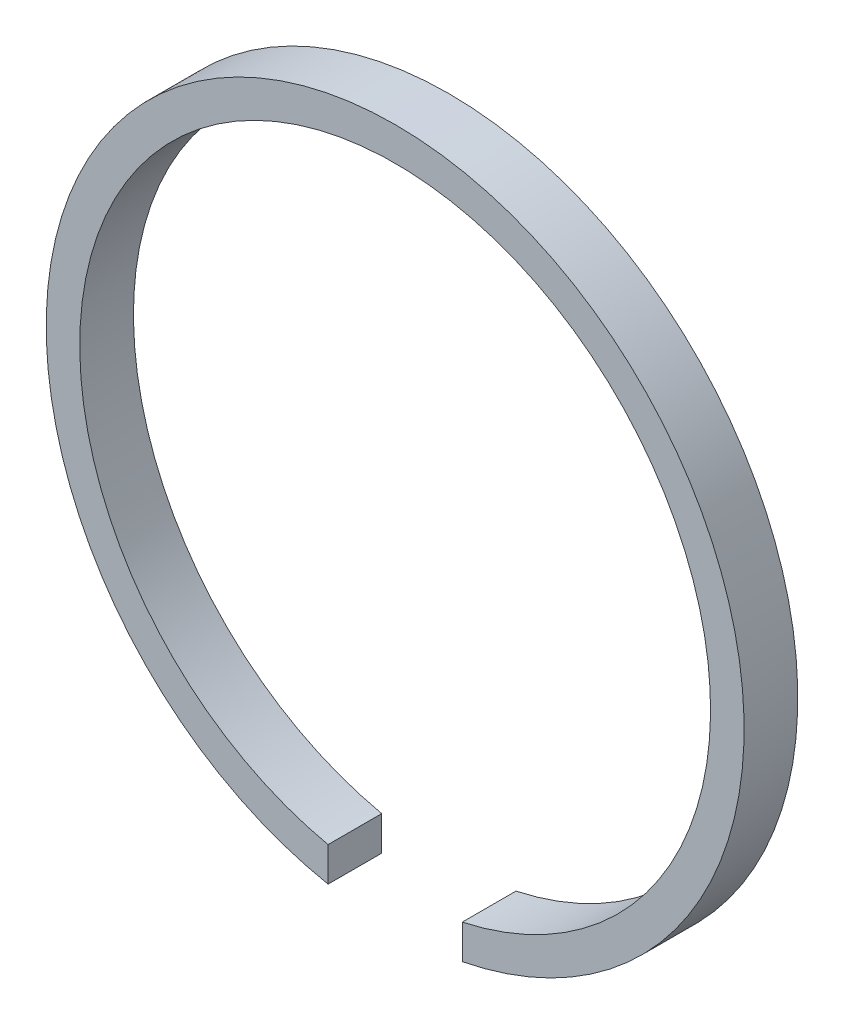
from build123d import *

# Parameters (mm, degrees)
EXTRUDE_1_DEPTH = 4


with BuildPart() as part:
    # 草图1 → 凸台-拉伸1 (new body)
    with BuildSketch(Plane.XY):
        with BuildLine():
            Line((-5, -25.514701644), (-5, -22.961925006))
            ThreePointArc((-5, -22.961925006), (-14.743642698, 18.299590159), (23.5, 0))
            ThreePointArc((23.5, 0), (18.299590159, -14.743642698), (5, -22.961925006))
            Line((5, -22.961925006), (5, -25.514701644))
            ThreePointArc((5, -25.514701644), (20.0748599, -16.522711642), (26, 0))
            ThreePointArc((26, 0), (-16.522711642, 20.0748599), (-5, -25.514701644))
        make_face()
    extrude(amount=EXTRUDE_1_DEPTH)


solid = part.part
